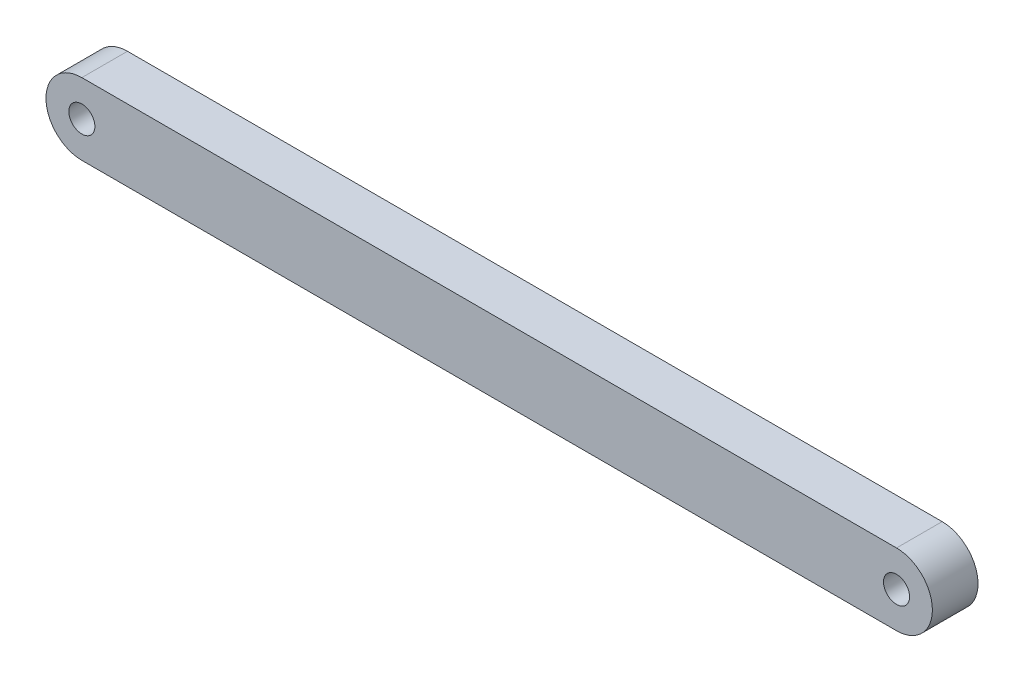
from build123d import *

# Parameters (mm, degrees)
EXTRUDE_1_DEPTH     = 14
SKETCH_2_R          = 4
CUT_EXTRUDE_1_DEPTH = 14


with BuildPart() as part:
    # 草图1 → 凸台-拉伸1 (new body)
    with BuildSketch(Plane.XY):
        with BuildLine():
            Line((0, 11), (250, 11))
            ThreePointArc((250, 11), (261, 0), (250, -11))
            Line((250, -11), (0, -11))
            ThreePointArc((0, -11), (-11, 0), (0, 11))
        make_face()
    extrude(amount=EXTRUDE_1_DEPTH)

    # 草图2 → 切除-拉伸1 (cut)
    with BuildSketch(Plane.XY):
        Circle(SKETCH_2_R)
        with Locations((250, 0)):
            Circle(SKETCH_2_R)
    extrude(amount=CUT_EXTRUDE_1_DEPTH, mode=Mode.SUBTRACT)


solid = part.part
